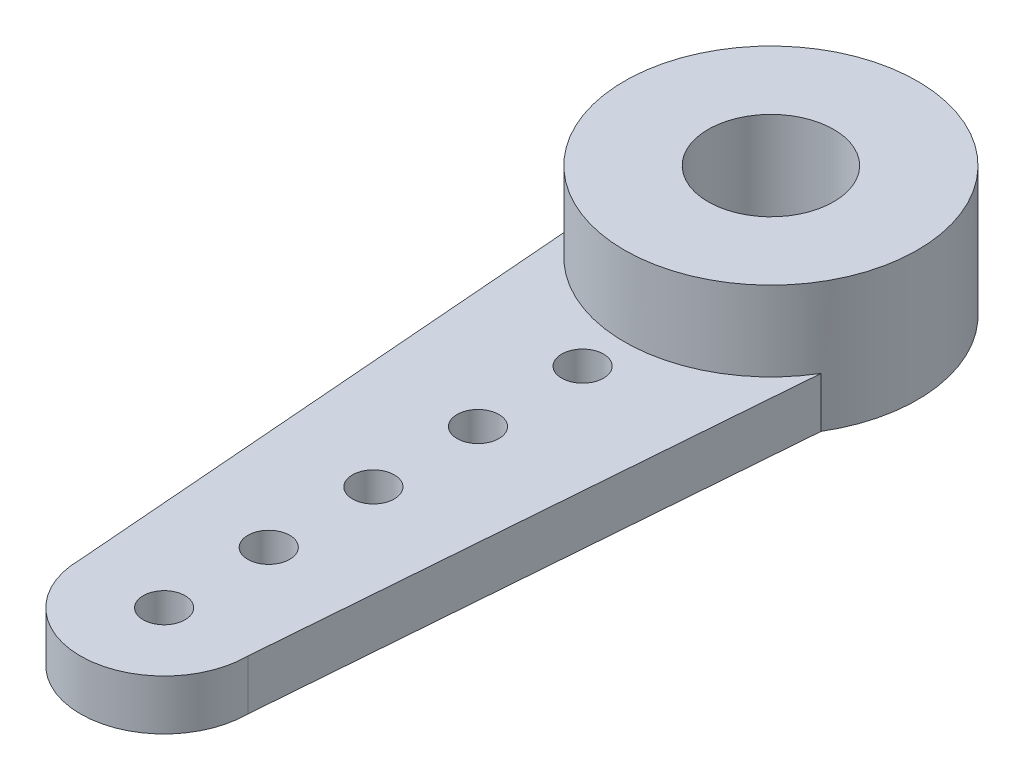
from build123d import *

# Parameters (mm, degrees)
SKETCH_1_R          = 3.5
EXTRUDE_1_DEPTH     = 3.1
EXTRUDE_2_DEPTH     = 1.2
SKETCH_3_R          = 1.5
CUT_EXTRUDE_1_DEPTH = 3
CUT_EXTRUDE_2_REACH = 18.974
SKETCH_4_R          = 0.5


with BuildPart() as part:
    # 草图1 → 凸台-拉伸1 (new body)
    with BuildSketch(Plane(origin=(0, 0, 0), x_dir=(1, 0, 0), z_dir=(0, 1, 0))):
        Circle(SKETCH_1_R)
    extrude(amount=EXTRUDE_1_DEPTH)

    # 草图2 → 凸台-拉伸2 (add)
    with BuildSketch(Plane(origin=(0, 0, 0), x_dir=(1, 0, 0), z_dir=(0, 1, 0))):
        with BuildLine():
            Line((-3, -1.802775638), (-2, -14.5))
            ThreePointArc((-2, -14.5), (0, -16.5), (2, -14.5))
            Line((2, -14.5), (3, -1.802775638))
            ThreePointArc((3, -1.802775638), (0, -3.5), (-3, -1.802775638))
        make_face()
    extrude(amount=EXTRUDE_2_DEPTH)

    # 草图3 → 切除-拉伸1 (cut)
    with BuildSketch(Plane(origin=(0, 3.1, 0), x_dir=(1, 0, 0), z_dir=(0, 1, 0))):
        Circle(SKETCH_3_R)
    extrude(amount=-CUT_EXTRUDE_1_DEPTH, mode=Mode.SUBTRACT)

    # 草图4 → 切除-拉伸2 (cut, up to next)
    with BuildSketch(Plane(origin=(0, 1.2, 0), x_dir=(1, 0, 0), z_dir=(0, 1, 0)), mode=Mode.PRIVATE) as cut_extrude_2_sk1:
        with Locations((0, -14.5)):
            Circle(SKETCH_4_R)
    cut_extrude_2_tool1 = extrude(cut_extrude_2_sk1.sketch, amount=-CUT_EXTRUDE_2_REACH, mode=Mode.PRIVATE) & part.part
    # 草图4 → 切除-拉伸2 (cut, up to next)
    with BuildSketch(Plane(origin=(0, 1.2, 0), x_dir=(1, 0, 0), z_dir=(0, 1, 0)), mode=Mode.PRIVATE) as cut_extrude_2_sk2:
        with Locations((0, -12)):
            Circle(SKETCH_4_R)
    cut_extrude_2_tool2 = extrude(cut_extrude_2_sk2.sketch, amount=-CUT_EXTRUDE_2_REACH, mode=Mode.PRIVATE) & part.part
    # 草图4 → 切除-拉伸2 (cut, up to next)
    with BuildSketch(Plane(origin=(0, 1.2, 0), x_dir=(1, 0, 0), z_dir=(0, 1, 0)), mode=Mode.PRIVATE) as cut_extrude_2_sk3:
        with Locations((0, -9.5)):
            Circle(SKETCH_4_R)
    cut_extrude_2_tool3 = extrude(cut_extrude_2_sk3.sketch, amount=-CUT_EXTRUDE_2_REACH, mode=Mode.PRIVATE) & part.part
    # 草图4 → 切除-拉伸2 (cut, up to next)
    with BuildSketch(Plane(origin=(0, 1.2, 0), x_dir=(1, 0, 0), z_dir=(0, 1, 0)), mode=Mode.PRIVATE) as cut_extrude_2_sk4:
        with Locations((0, -7)):
            Circle(SKETCH_4_R)
    cut_extrude_2_tool4 = extrude(cut_extrude_2_sk4.sketch, amount=-CUT_EXTRUDE_2_REACH, mode=Mode.PRIVATE) & part.part
    # 草图4 → 切除-拉伸2 (cut, up to next)
    with BuildSketch(Plane(origin=(0, 1.2, 0), x_dir=(1, 0, 0), z_dir=(0, 1, 0)), mode=Mode.PRIVATE) as cut_extrude_2_sk5:
        with Locations((0, -4.5)):
            Circle(SKETCH_4_R)
    cut_extrude_2_tool5 = extrude(cut_extrude_2_sk5.sketch, amount=-CUT_EXTRUDE_2_REACH, mode=Mode.PRIVATE) & part.part
    add(cut_extrude_2_tool1.solids().sort_by_distance((0, 1.2, 14.5))[0], mode=Mode.SUBTRACT)
    add(cut_extrude_2_tool2.solids().sort_by_distance((0, 1.2, 12))[0], mode=Mode.SUBTRACT)
    add(cut_extrude_2_tool3.solids().sort_by_distance((0, 1.2, 9.5))[0], mode=Mode.SUBTRACT)
    add(cut_extrude_2_tool4.solids().sort_by_distance((0, 1.2, 7))[0], mode=Mode.SUBTRACT)
    add(cut_extrude_2_tool5.solids().sort_by_distance((0, 1.2, 4.5))[0], mode=Mode.SUBTRACT)


solid = part.part
